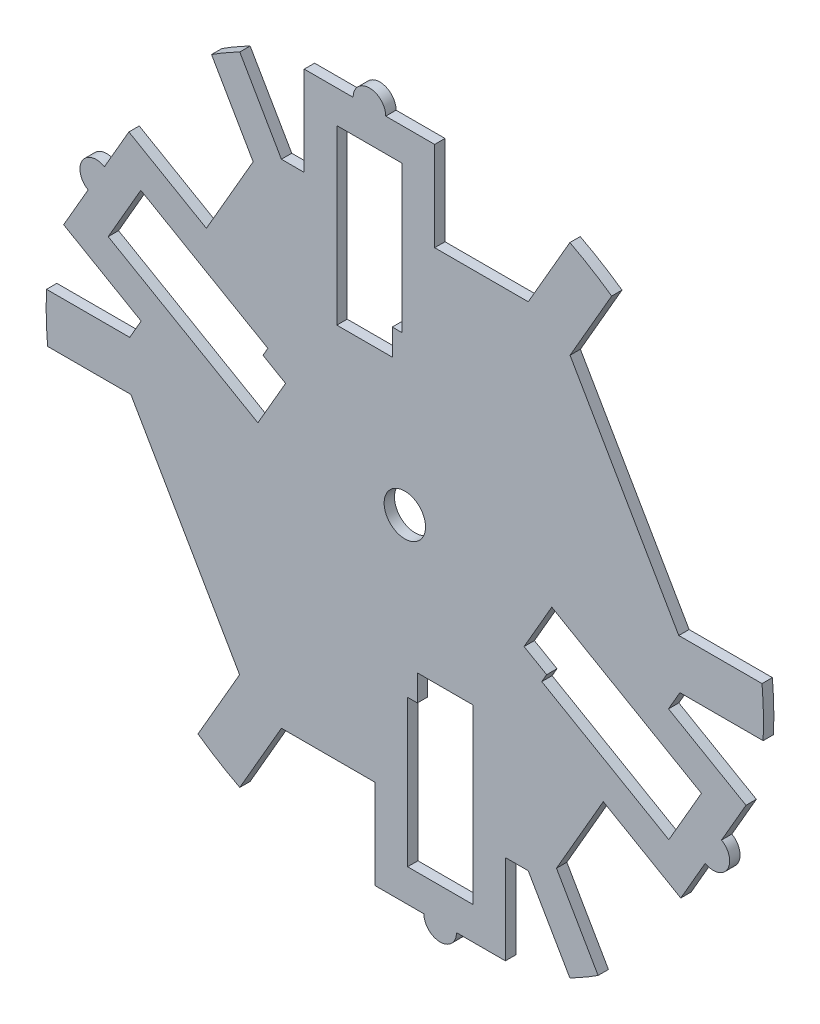
from build123d import *

# Parameters (mm, degrees)
SKETCH1_R                = 110
SKETCH1_R_2              = 6.35
BOSS_EXTRUDE1_DEPTH      = 1.5875
CUT_EXTRUDE3_DEPTH       = 156.595888844
CIRPATTERN1_COUNT        = 2
CIRPATTERN2_COUNT        = 2
CIRPATTERN2_ANGLE        = 60
CIRPATTERN2_COPY_1_DEPTH = 156.595888844
CUT_EXTRUDE5_DEPTH       = 155.188458145


with BuildPart() as part:
    # Sketch1 → Boss-Extrude1 (new, symmetric)
    with BuildSketch(Plane.XY):
        Circle(SKETCH1_R)
        Circle(SKETCH1_R_2, mode=Mode.SUBTRACT)
        Polygon((-6.35, 40), (-3.85, 40), (-3.85, 48), (-0.85, 48), (-0.85, 93), (-20.85, 93), (-20.85, 40), (-18.35, 40), align=None, mode=Mode.SUBTRACT)
        Polygon((6.35, -40), (3.85, -40), (3.85, -48), (0.85, -48), (0.85, -93), (20.85, -93), (20.85, -40), (18.35, -40), align=None, mode=Mode.SUBTRACT)
        Polygon((37.816016151, -14.500738686), (36.566016151, -16.665802195), (43.494219382, -20.665802195), (41.994219382, -23.263878407), (80.965362552, -45.763878407), (90.965362552, -28.443370331), (45.066016151, -1.943370331), (43.816016151, -4.108433841), align=None, mode=Mode.SUBTRACT)
        Polygon((-37.816016151, 14.500738686), (-36.566016151, 16.665802195), (-43.494219382, 20.665802195), (-41.994219382, 23.263878407), (-80.965362552, 45.763878407), (-90.965362552, 28.443370331), (-45.066016151, 1.943370331), (-43.816016151, 4.108433841), align=None, mode=Mode.SUBTRACT)
    extrude(amount=BOSS_EXTRUDE1_DEPTH, both=True)

    # Sketch2 → Cut-Extrude3 (cut, through all)
    with BuildSketch(Plane.XY.offset(1.5875)):
        with BuildLine():
            Line((-50.613025421, -97.664331553), (-37.85, -75.558123066))
            Line((-37.85, -75.558123066), (-9.15, -75.558123066))
            Line((-9.15, -75.558123066), (-9.15, -103))
            Line((-9.15, -103), (5.85, -103))
            ThreePointArc((5.85, -103), (10.85, -108), (15.85, -103))
            Line((15.85, -103), (30.85, -103))
            Line((30.85, -103), (30.85, -75.558123066))
            Line((30.85, -75.558123066), (37.85, -75.558123066))
            Line((37.85, -75.558123066), (50.613025421, -97.664331553))
            ThreePointArc((50.613025421, -97.664331553), (0, -110), (-50.613025421, -97.664331553))
        make_face()
    cut_extrude3 = extrude(amount=-CUT_EXTRUDE3_DEPTH, mode=Mode.SUBTRACT)

    # CirPattern1: Cut-Extrude3 ×2 about axis
    cirpattern1_axis = Axis((0, 0, 0), (0, 0, 1))
    for i in range(1, CIRPATTERN1_COUNT):
        add(cut_extrude3.rotate(cirpattern1_axis, i * 360 / CIRPATTERN1_COUNT), mode=Mode.SUBTRACT)

    # CirPattern2: Cut-Extrude3 ×2 about axis
    cirpattern2_axis = Axis((0, 0, 0), (0, 0, 1))
    for i in range(1, CIRPATTERN2_COUNT):
        add(cut_extrude3.rotate(cirpattern2_axis, i * CIRPATTERN2_ANGLE / (CIRPATTERN2_COUNT - 1)), mode=Mode.SUBTRACT)

    # CirPattern2 copy 1 sketch → CirPattern2 copy 1 (cut, through all)
    with BuildSketch(Plane(origin=(0, 0, 1.5875), x_dir=(-0.4999999999999979, -0.8660254037844398, 0), z_dir=(0, 0, 1))):
        with BuildLine():
            Line((-50.613025421, -97.664331553), (-37.85, -75.558123066))
            Line((-37.85, -75.558123066), (-9.15, -75.558123066))
            Line((-9.15, -75.558123066), (-9.15, -103))
            Line((-9.15, -103), (5.85, -103))
            ThreePointArc((5.85, -103), (10.85, -108), (15.85, -103))
            Line((15.85, -103), (30.85, -103))
            Line((30.85, -103), (30.85, -75.558123066))
            Line((30.85, -75.558123066), (37.85, -75.558123066))
            Line((37.85, -75.558123066), (50.613025421, -97.664331553))
            ThreePointArc((50.613025421, -97.664331553), (0, -110), (-50.613025421, -97.664331553))
        make_face()
    extrude(amount=-CIRPATTERN2_COPY_1_DEPTH, mode=Mode.SUBTRACT)

    # Sketch5 → Cut-Extrude5 (cut, through all)
    with BuildSketch(Plane.XY.offset(1.5875)):
        with BuildLine():
            Line((-109.544511501, -10), (-84.014511501, -10))
            Line((-84.014511501, -10), (-50.667509788, -67.758701246))
            Line((-50.667509788, -67.758701246), (-63.432509788, -89.868329805))
            ThreePointArc((-63.432509788, -89.868329805), (-95.262794416, -55), (-109.544511501, -10))
        make_face()
        with BuildLine():
            Line((109.544511501, 10), (84.014511501, 10))
            Line((84.014511501, 10), (50.667509788, 67.758701246))
            Line((50.667509788, 67.758701246), (63.432509788, 89.868329805))
            ThreePointArc((63.432509788, 89.868329805), (95.262794416, 55), (109.544511501, 10))
        make_face()
    extrude(amount=-CUT_EXTRUDE5_DEPTH, mode=Mode.SUBTRACT)


solid = part.part
